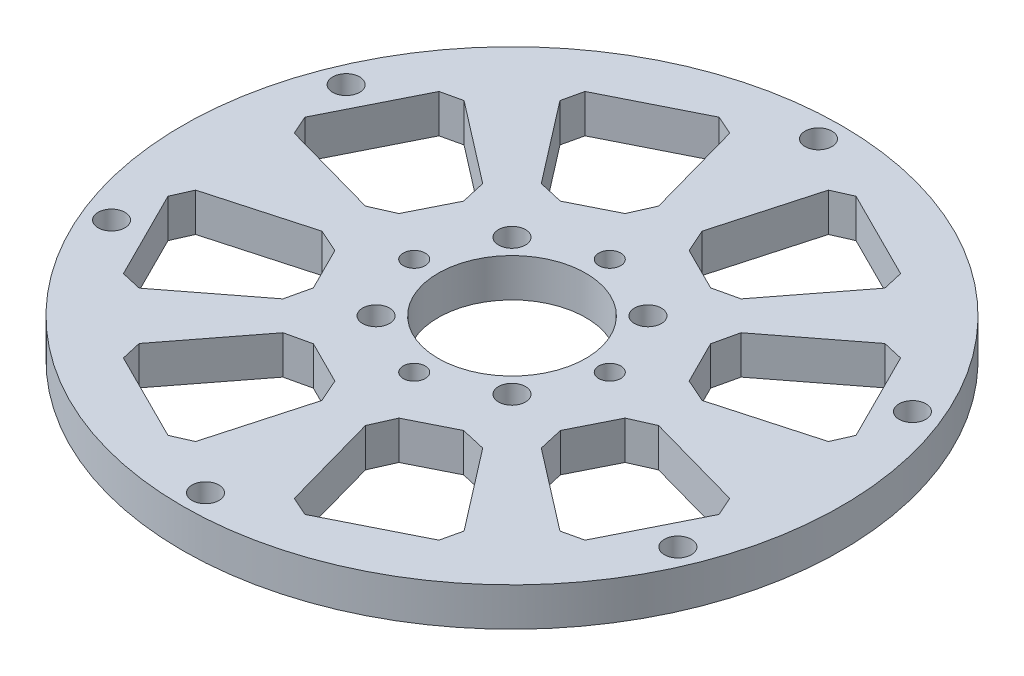
from build123d import *

# Parameters (mm, degrees)
SKETCH1_R               = 60
BOSS_EXTRUDE1_DEPTH     = 7
CUT_EXTRUDE1_DEPTH      = 86.141059425
CUT_EXTRUDE1_DEPTH_BACK = 20
SKETCH7_R               = 13.442894491
CUT_EXTRUDE2_DEPTH      = 20
CUT_EXTRUDE3_DEPTH      = 4
CUT_EXTRUDE3_DEPTH_BACK = 2
SKETCH9_R               = 3.5
SKETCH13_R              = 2
CUT_EXTRUDE4_DEPTH      = 86.141059425
SKETCH14_R              = 3
CUT_EXTRUDE5_DEPTH      = 3
SKETCH15_R              = 2.45
CUT_EXTRUDE6_DEPTH      = 85.947042326
SKETCH16_R              = 3
CUT_EXTRUDE7_DEPTH      = 3
SKETCH17_R              = 2.45
CUT_EXTRUDE8_DEPTH      = 86.141059425
CUT_EXTRUDE9_DEPTH      = 1
FILLET2_R               = 0.005


with BuildPart() as part:
    # Sketch1 → Boss-Extrude1 (new body)
    with BuildSketch(Plane(origin=(0, 0, 0), x_dir=(1, 0, 0), z_dir=(0, 1, 0))):
        with Locations(Location((0, 0, 0), (0, 0, 270))):
            Circle(SKETCH1_R)
    extrude(amount=BOSS_EXTRUDE1_DEPTH)

    # Sketch5 → Cut-Extrude1 (cut, two sides: drawn at the far end of the back side and taken through both)
    with BuildSketch(Plane(origin=(0, 0, 0), x_dir=(1, 0, 0), z_dir=(0, 1, 0)).offset(-CUT_EXTRUDE1_DEPTH_BACK)):
        Polygon((-12.468903546, 50.167122687), (-28.724188041, 42.022350038), (-29.575349406, 38.302005643), (-18.186693565, 23.520652463), (-13.673554926, 22.488111162), (-5.8318542, 26.41722539), (-3.957136141, 30.650426793), (-8.979321601, 48.621724378), align=None)
        Polygon((-22.488111162, 13.673554926), (-26.41722539, 5.8318542), (-30.650426793, 3.957136141), (-48.621724378, 8.979321601), (-50.167122687, 12.468903546), (-42.022350038, 28.724188041), (-38.302005643, 29.575349406), (-23.520652463, 18.186693565), align=None)
        Polygon((22.488111162, 13.673554926), (26.41722539, 5.8318542), (30.650426793, 3.957136141), (48.621724378, 8.979321601), (50.167122687, 12.468903546), (42.022350038, 28.724188041), (38.302005643, 29.575349406), (23.520652463, 18.186693565), align=None)
        Polygon((13.673554926, 22.488111162), (5.8318542, 26.41722539), (3.957136141, 30.650426793), (8.979321601, 48.621724378), (12.468903546, 50.167122687), (28.724188041, 42.022350038), (29.575349406, 38.302005643), (18.186693565, 23.520652463), align=None)
        Polygon((22.488111162, -13.673554926), (26.41722539, -5.8318542), (30.650426793, -3.957136141), (48.621724378, -8.979321601), (50.167122687, -12.468903546), (42.022350038, -28.724188041), (38.302005643, -29.575349406), (23.520652463, -18.186693565), align=None)
        Polygon((13.673554926, -22.488111162), (5.8318542, -26.41722539), (3.957136141, -30.650426793), (8.979321601, -48.621724378), (12.468903546, -50.167122687), (28.724188041, -42.022350038), (29.575349406, -38.302005643), (18.186693565, -23.520652463), align=None)
        Polygon((-13.673554926, -22.488111162), (-5.8318542, -26.41722539), (-3.957136141, -30.650426793), (-8.979321601, -48.621724378), (-12.468903546, -50.167122687), (-28.724188041, -42.022350038), (-29.575349406, -38.302005643), (-18.186693565, -23.520652463), align=None)
        Polygon((-22.488111162, -13.673554926), (-26.41722539, -5.8318542), (-30.650426793, -3.957136141), (-48.621724378, -8.979321601), (-50.167122687, -12.468903546), (-42.022350038, -28.724188041), (-38.302005643, -29.575349406), (-23.520652463, -18.186693565), align=None)
    extrude(amount=CUT_EXTRUDE1_DEPTH + CUT_EXTRUDE1_DEPTH_BACK, mode=Mode.SUBTRACT)

    # Sketch7 → Cut-Extrude2 (cut)
    with BuildSketch(Plane(origin=(0, 7, 0), x_dir=(1, 0, 0), z_dir=(0, 1, 0))):
        with Locations(Location((0, 0, 0), (0, 0, 270))):
            Circle(SKETCH7_R)
    extrude(amount=-CUT_EXTRUDE2_DEPTH, mode=Mode.SUBTRACT)

    # Sketch9 → Cut-Extrude3 (cut, two sides: drawn at the far end of the back side and taken through both)
    with BuildSketch(Plane(origin=(0, 0, 0), x_dir=(1, 0, 0), z_dir=(0, 1, 0)).offset(-CUT_EXTRUDE3_DEPTH_BACK)):
        with Locations(Location((0, 17.8, 0), (0, 0, 270))):
            Circle(SKETCH9_R)
        with Locations(Location((17.8, 0, 0), (0, 0, 270))):
            Circle(SKETCH9_R)
        with Locations(Location((0, -17.8, 0), (0, 0, 90))):
            Circle(SKETCH9_R)
        with Locations(Location((-17.8, 0, 0), (0, 0, 90))):
            Circle(SKETCH9_R)
    extrude(amount=CUT_EXTRUDE3_DEPTH + CUT_EXTRUDE3_DEPTH_BACK, mode=Mode.SUBTRACT)

    # Sketch13 → Cut-Extrude4 (cut, through all)
    with BuildSketch(Plane(origin=(0, 0, 0), x_dir=(-1, 0, 0), z_dir=(0, -1, 0))):
        with Locations(Location((0, -17.8, 0), (0, 0, 90))):
            Circle(SKETCH13_R)
        with Locations(Location((-17.8, 0, 0), (0, 0, 90))):
            Circle(SKETCH13_R)
        with Locations(Location((0, 17.8, 0), (0, 0, 270))):
            Circle(SKETCH13_R)
        with Locations(Location((17.8, 0, 0), (0, 0, 90))):
            Circle(SKETCH13_R)
    extrude(amount=-CUT_EXTRUDE4_DEPTH, mode=Mode.SUBTRACT)

    # Sketch14 → Cut-Extrude5 (cut)
    with BuildSketch(Plane(origin=(0, 0, 0), x_dir=(-1, 0, 0), z_dir=(0, -1, 0))):
        with Locations(Location((12.374368671, -12.374368671, 0), (0, 0, 270))):
            Circle(SKETCH14_R)
        with Locations(Location((-12.374368671, -12.374368671, 0), (0, 0, 270))):
            Circle(SKETCH14_R)
        with Locations(Location((-12.374368671, 12.374368671, 0), (0, 0, 270))):
            Circle(SKETCH14_R)
        with Locations(Location((12.374368671, 12.374368671, 0), (0, 0, 270))):
            Circle(SKETCH14_R)
    extrude(amount=-CUT_EXTRUDE5_DEPTH, mode=Mode.SUBTRACT)

    # Sketch15 → Cut-Extrude6 (cut, through all)
    with BuildSketch(Plane(origin=(0, 3, 0), x_dir=(-1, 0, 0), z_dir=(0, -1, 0))):
        with Locations(Location((-12.374368671, -12.374368671, 0), (0, 0, 90))):
            Circle(SKETCH15_R)
        with Locations(Location((12.374368671, -12.374368671, 0), (0, 0, 90))):
            Circle(SKETCH15_R)
        with Locations(Location((12.374368671, 12.374368671, 0), (0, 0, 90))):
            Circle(SKETCH15_R)
        with Locations(Location((-12.374368671, 12.374368671, 0), (0, 0, 90))):
            Circle(SKETCH15_R)
    extrude(amount=-CUT_EXTRUDE6_DEPTH, mode=Mode.SUBTRACT)

    # Sketch16 → Cut-Extrude7 (cut)
    with BuildSketch(Plane(origin=(0, 0, 0), x_dir=(-1, 0, 0), z_dir=(0, -1, 0))):
        with Locations(Location((-51.552477914, 21.353735526, 0), (0, 0, 270))):
            Circle(SKETCH16_R)
        with Locations(Location((-51.552477914, -21.353735526, 0), (0, 0, 270))):
            Circle(SKETCH16_R)
        with Locations(Location((51.552477914, 21.353735526, 0), (0, 0, 270))):
            Circle(SKETCH16_R)
        with Locations(Location((51.552477914, -21.353735526, 0), (0, 0, 270))):
            Circle(SKETCH16_R)
        with Locations(Location((0, 55.8, 0), (0, 0, 270))):
            Circle(SKETCH16_R)
        with Locations(Location((0, -55.8, 0), (0, 0, 270))):
            Circle(SKETCH16_R)
    extrude(amount=-CUT_EXTRUDE7_DEPTH, mode=Mode.SUBTRACT)

    # Sketch17 → Cut-Extrude8 (cut, through all)
    with BuildSketch(Plane.XZ):
        with Locations(Location((-51.552477914, 21.353735526, 0), (0, 0, 270))):
            Circle(SKETCH17_R)
        with Locations(Location((-51.552477914, -21.353735526, 0), (0, 0, 90))):
            Circle(SKETCH17_R)
        with Locations(Location((51.552477914, -21.353735526, 0), (0, 0, 270))):
            Circle(SKETCH17_R)
        with Locations(Location((51.552477914, 21.353735526, 0), (0, 0, 90))):
            Circle(SKETCH17_R)
        with Locations(Location((0, -55.8, 0), (0, 0, 270))):
            Circle(SKETCH17_R)
        with Locations(Location((0, 55.8, 0), (0, 0, 90))):
            Circle(SKETCH17_R)
    extrude(amount=-CUT_EXTRUDE8_DEPTH, mode=Mode.SUBTRACT)

    # Sketch18 → Cut-Extrude9 (cut)
    with BuildSketch(Plane.XZ):
        with BuildLine():
            Line((3.004044194, 48.113779502), (3.004044194, 35.332130299))
            ThreePointArc((3.004044194, 35.332130299), (0, 32.328086105), (-3.004044194, 35.332130299))
            Line((-3.004044194, 35.332130299), (-3.004044194, 48.113779502))
            ThreePointArc((-3.004044194, 48.113779502), (0, 51.117823696), (3.004044194, 48.113779502))
        make_face()
        with BuildLine():
            Line((3.004044194, -48.113779502), (3.004044194, -35.332130299))
            ThreePointArc((3.004044194, -35.332130299), (0, -32.328086105), (-3.004044194, -35.332130299))
            Line((-3.004044194, -35.332130299), (-3.004044194, -48.113779502))
            ThreePointArc((-3.004044194, -48.113779502), (0, -51.117823696), (3.004044194, -48.113779502))
        make_face()
    extrude(amount=-CUT_EXTRUDE9_DEPTH, mode=Mode.SUBTRACT)

    # Fillet2
    fillet2_edges = [part.edges().sort_by_distance(p)[0] for p in [
        (0, 0, 32.328086105),
        (-3.004044194, 1, 41.7229549),
        (0, 0, 51.117823696),
        (3.004044194, 1, 41.7229549),
        (0, 1, 32.328086105),
        (0, 1, 51.117823696),
        (3.004044194, 0, 41.7229549),
        (-3.004044194, 0, 41.7229549),
    ]]
    fillet(fillet2_edges, radius=FILLET2_R)


solid = part.part
